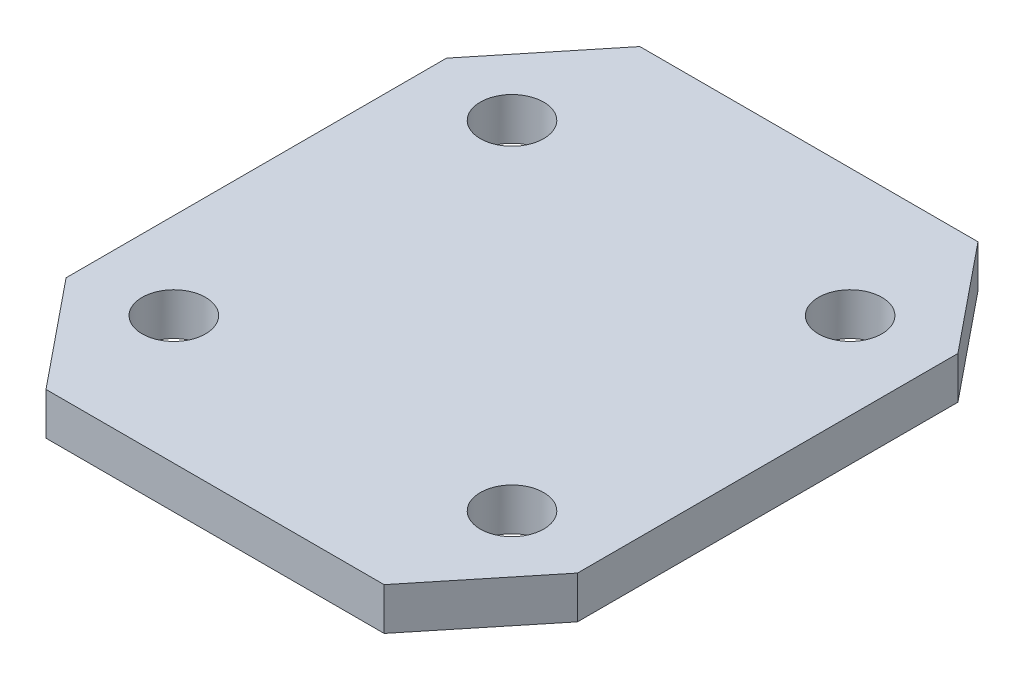
from build123d import *

# Parameters (mm, degrees)
BOSS_EXTRUDE1_DEPTH = 2
SKETCH2_R           = 1.5
CUT_EXTRUDE1_DEPTH  = 10


with BuildPart() as part:
    # Sketch1 → Boss-Extrude1 (new body)
    with BuildSketch(Plane(origin=(0, 0, 0), x_dir=(1, 0, 0), z_dir=(0, 1, 0))):
        Polygon((-12.1, 9), (-8, 14.05), (8, 14.05), (12.1, 9), (12.1, -9), (8, -14.05), (-8, -14.05), (-12.1, -9), align=None)
    extrude(amount=BOSS_EXTRUDE1_DEPTH)

    # Sketch2 → Cut-Extrude1 (cut)
    with BuildSketch(Plane(origin=(0, 2, 0), x_dir=(1, 0, 0), z_dir=(0, 1, 0))):
        with Locations(Location((-8, 8, 0), (0, 0, 270))):
            Circle(SKETCH2_R)
        with Locations(Location((8, 8, 0), (0, 0, 270))):
            Circle(SKETCH2_R)
        with Locations(Location((-8, -8, 0), (0, 0, 270))):
            Circle(SKETCH2_R)
        with Locations(Location((8, -8, 0), (0, 0, 270))):
            Circle(SKETCH2_R)
    extrude(amount=-CUT_EXTRUDE1_DEPTH, mode=Mode.SUBTRACT)


solid = part.part
